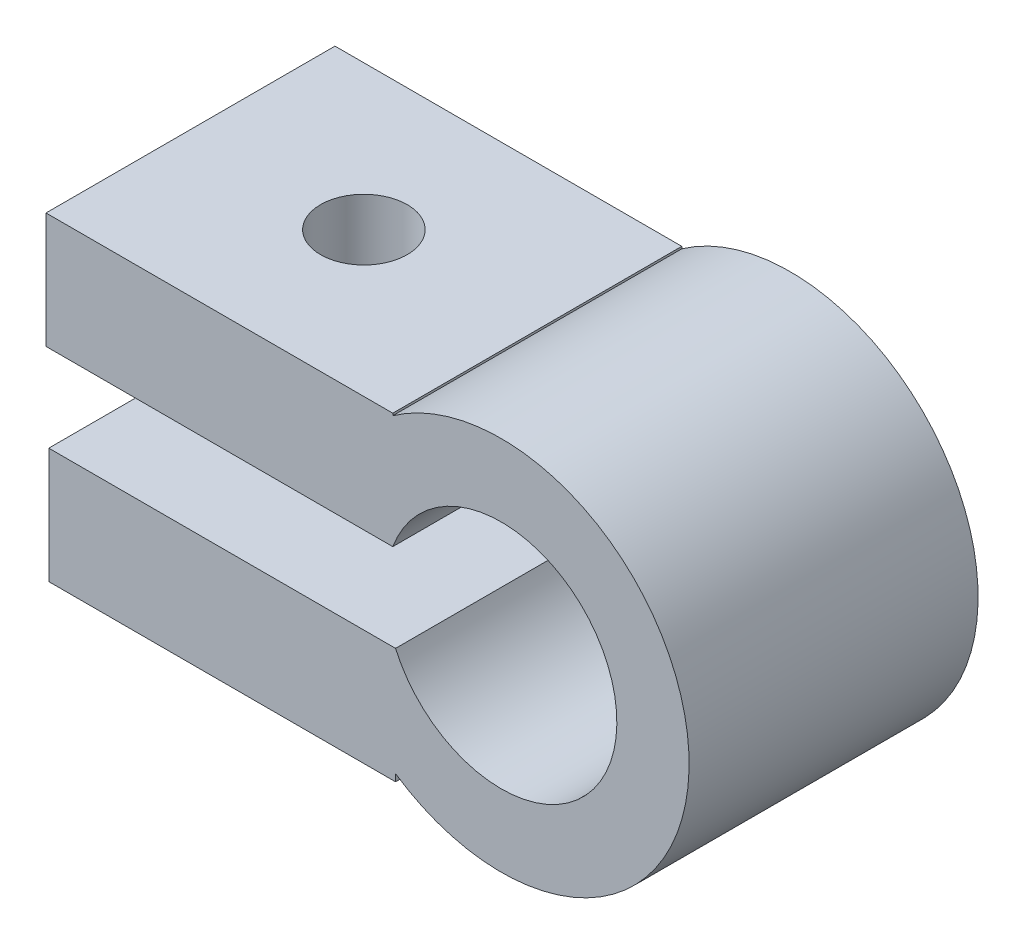
from build123d import *

# Parameters (mm, degrees)
SKETCH1_R           = 6.5
SKETCH1_R_2         = 4
BOSS_EXTRUDE1_DEPTH = 10
SKETCH2_W           = 3.218226301
SKETCH2_H           = 3
CUT_EXTRUDE1_DEPTH  = 33
SKETCH3_W           = 12
SKETCH3_H           = 4
BOSS_EXTRUDE2_DEPTH = 10
SKETCH4_R           = 1.5
CUT_EXTRUDE2_DEPTH  = 40
CUT_EXTRUDE3_DEPTH  = 3


with BuildPart() as part:
    # Sketch1 → Boss-Extrude1 (new body)
    with BuildSketch(Plane.XY):
        with Locations((-12.315422017, 2.550703256)):
            Circle(SKETCH1_R)
        with Locations((-12.315422017, 2.550703256)):
            Circle(SKETCH1_R_2, mode=Mode.SUBTRACT)
    extrude(amount=BOSS_EXTRUDE1_DEPTH)

    # Sketch2 → Cut-Extrude1 (cut)
    with BuildSketch(Plane.XY.offset(10)):
        with Locations((-17.357309889, 2.432650589)):
            Rectangle(SKETCH2_W, SKETCH2_H)
    extrude(amount=-CUT_EXTRUDE1_DEPTH, mode=Mode.SUBTRACT)

    # Sketch3 → Boss-Extrude2 (add)
    with BuildSketch(Plane.XY.offset(10)):
        with Locations((-21.973550714, -1.067349411)):
            Rectangle(SKETCH3_W, SKETCH3_H)
        with Locations((-22.069116407, 5.932650589)):
            Rectangle(SKETCH3_W, SKETCH3_H)
    extrude(amount=-BOSS_EXTRUDE2_DEPTH)

    # Sketch4 → Cut-Extrude2 (cut)
    with BuildSketch(Plane(origin=(0, 7.932650589, 0), x_dir=(1, 0, 0), z_dir=(0, 1, 0))):
        with Locations(Location((-22.069116407, -5, 0), (0, 0, 180))):
            Circle(SKETCH4_R)
    extrude(amount=-CUT_EXTRUDE2_DEPTH, mode=Mode.SUBTRACT)

    # Sketch5 → Cut-Extrude3 (cut)
    with BuildSketch(Plane(origin=(0, -3.067349411, 0), x_dir=(-1, 0, 0), z_dir=(0, -1, 0))):
        Polygon((19.051149057, -6.669474185), (22.051149057, -8.401524993), (25.051149057, -6.669474185), (25.051149057, -3.20537257), (22.051149057, -1.473321762), (19.051149057, -3.20537257), align=None)
    extrude(amount=-CUT_EXTRUDE3_DEPTH, mode=Mode.SUBTRACT)


solid = part.part
